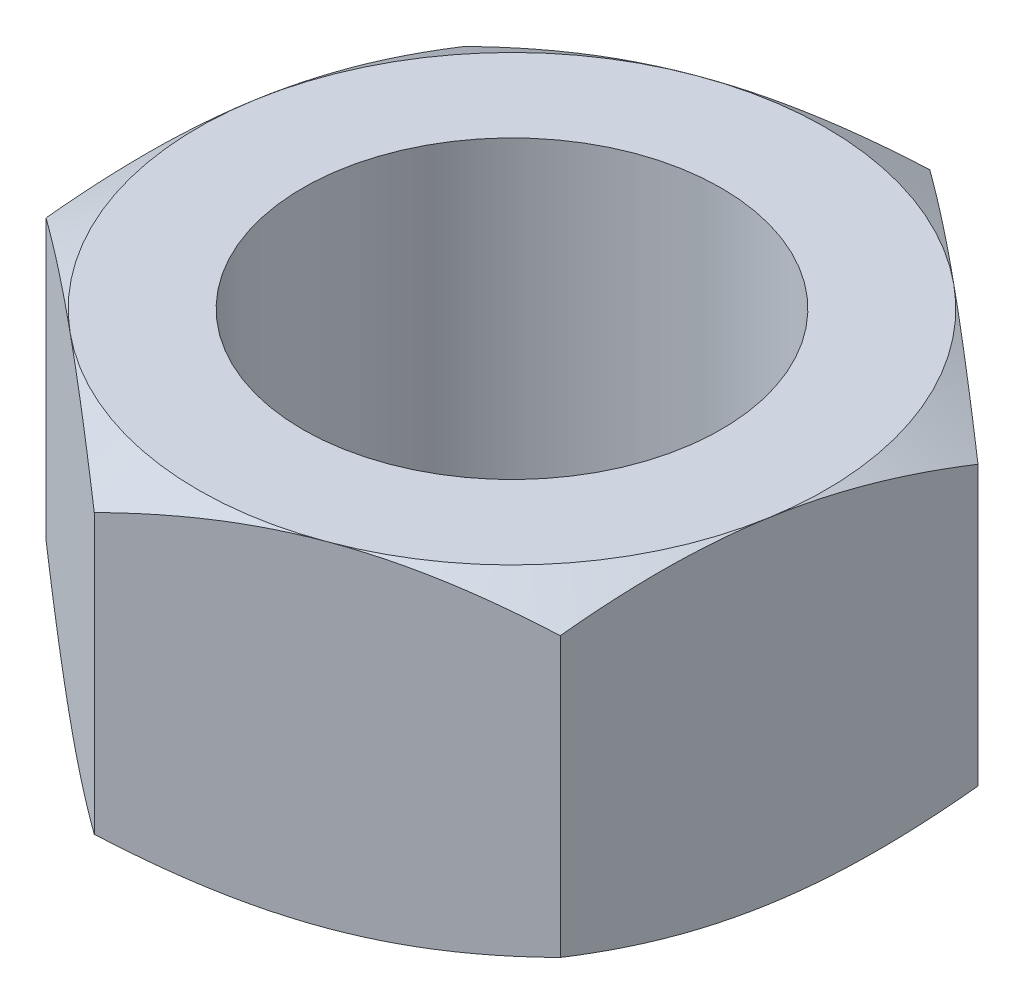
from build123d import *

# Parameters (mm, degrees)
BOSS_EXTRUDE1_DEPTH = 8
SKETCH7_OUTSIDE_W   = 26.674
SKETCH7_OUTSIDE_H   = 27.518
SKETCH7_OUTSIDE_R   = 7.5
CUT_EXTRUDE4_DEPTH  = 1
CUT_EXTRUDE4_DRAFT  = -60
SKETCH8_OUTSIDE_W   = 26.674
SKETCH8_OUTSIDE_H   = 27.518
SKETCH8_OUTSIDE_R   = 7.5
CUT_EXTRUDE5_DEPTH  = 1
CUT_EXTRUDE5_DRAFT  = -60
SKETCH9_R           = 5
CUT_EXTRUDE6_DEPTH  = 10


with BuildPart() as part:
    # Sketch1 → Boss-Extrude1 (new body)
    with BuildSketch(Plane(origin=(0, 0, 0), x_dir=(1, 0, 0), z_dir=(0, 1, 0))):
        Polygon((6.673205692, -5.519812116), (8.116900362, 3.019259596), (1.44369467, 8.539071712), (-6.673205692, 5.519812116), (-8.116900362, -3.019259596), (-1.44369467, -8.539071712), align=None)
    extrude(amount=BOSS_EXTRUDE1_DEPTH)


with BuildPart() as cut_extrude4_tool:
    # Sketch7 outside → Cut-Extrude4 (with draft: the straight prism first)
    with BuildSketch(Plane(origin=(0, 8, 0), x_dir=(1, 0, 0), z_dir=(0, 1, 0))):
        Rectangle(SKETCH7_OUTSIDE_W, SKETCH7_OUTSIDE_H)
        Circle(SKETCH7_OUTSIDE_R, mode=Mode.SUBTRACT)
    extrude(amount=-CUT_EXTRUDE4_DEPTH)
    # Cut-Extrude4: the draft: its side faces are tilted about the plane it starts from
    cut_extrude4_sides = [cut_extrude4_tool.faces().sort_by_distance(p)[0] for p in [
        (0, 7.5, 13.759),
        (13.337, 7.5, 0),
        (0, 7.5, -13.759),
        (-13.337, 7.5, 0),
        (-7.5, 7.5, 0),
    ]]
    draft(cut_extrude4_sides, Plane(origin=(0, 8, 0), x_dir=(1, 0, 0), z_dir=(0, 1, 0)), CUT_EXTRUDE4_DRAFT)


with BuildPart() as part_1:
    add(part.part)

    # Cut-Extrude4: cut by cut_extrude4_tool
    add(cut_extrude4_tool.part, mode=Mode.SUBTRACT)


with BuildPart() as cut_extrude5_tool:
    # Sketch8 outside → Cut-Extrude5 (with draft: the straight prism first)
    with BuildSketch(Plane.XZ):
        Rectangle(SKETCH8_OUTSIDE_W, SKETCH8_OUTSIDE_H)
        Circle(SKETCH8_OUTSIDE_R, mode=Mode.SUBTRACT)
    extrude(amount=-CUT_EXTRUDE5_DEPTH)
    # Cut-Extrude5: the draft: its side faces are tilted about the plane it starts from
    cut_extrude5_sides = [cut_extrude5_tool.faces().sort_by_distance(p)[0] for p in [
        (0, 0.5, -13.759),
        (13.337, 0.5, 0),
        (0, 0.5, 13.759),
        (-13.337, 0.5, 0),
        (-7.5, 0.5, 0),
    ]]
    draft(cut_extrude5_sides, Plane.XZ, CUT_EXTRUDE5_DRAFT)


with BuildPart() as part_2:
    add(part_1.part)

    # Cut-Extrude5: cut by cut_extrude5_tool
    add(cut_extrude5_tool.part, mode=Mode.SUBTRACT)

    # Sketch9 → Cut-Extrude6 (cut)
    with BuildSketch(Plane(origin=(0, 8, 0), x_dir=(1, 0, 0), z_dir=(0, 1, 0))):
        with Locations(Location((0, 0, 0), (0, 0, 270))):
            Circle(SKETCH9_R)
    extrude(amount=-CUT_EXTRUDE6_DEPTH, mode=Mode.SUBTRACT)


solid = part_2.part
